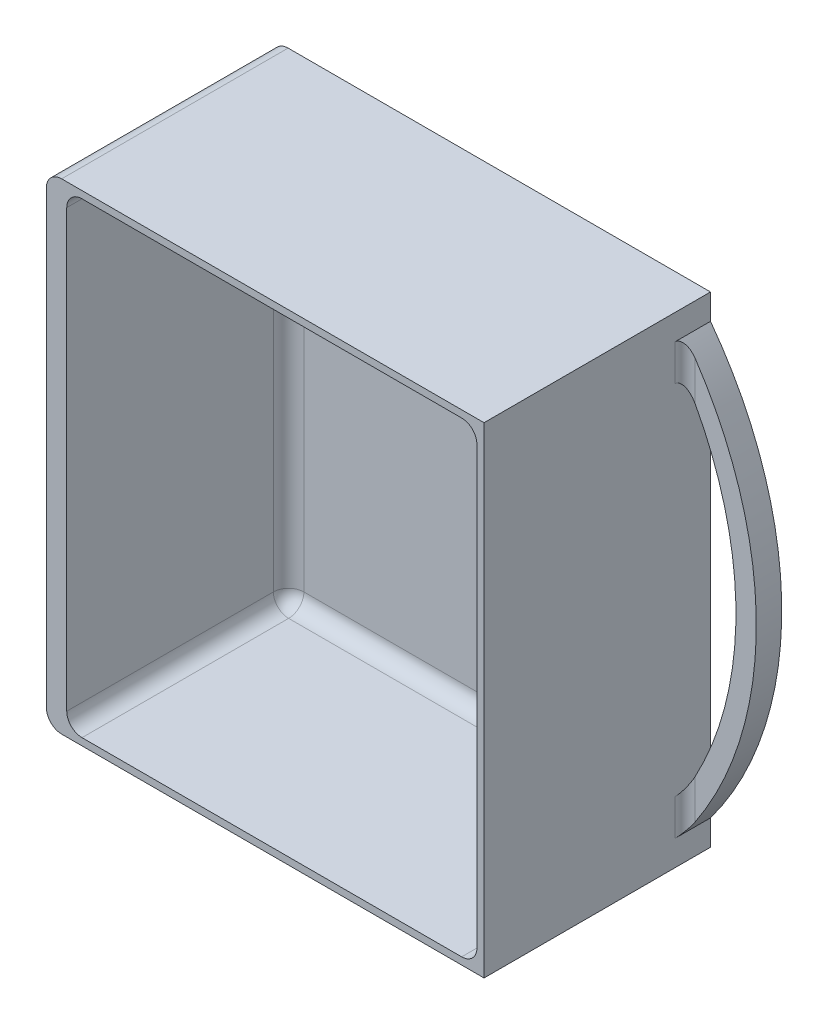
from build123d import *

# Parameters (mm, degrees)
SKETCH_1_W                  = 86
SKETCH_1_H                  = 94.5
EXTRUDE_1_DEPTH             = 39.5
EXTRUDE_2_DEPTH             = 5
SKETCH_3_W                  = 80.6
SKETCH_3_H                  = 91.7
CUT_EXTRUDE_1_DEPTH         = 43.6
HOLE_WIZARD_8_3_8_3_1_D     = 8.3
HOLE_WIZARD_8_3_8_3_1_DEPTH = 3.2
FILLET_1_R                  = 3
SKETCH_7_R                  = 4.2
EXTRUDE_3_DEPTH             = 3.8
FILLET_2_R                  = 3
FILLET_3_R                  = 3
FILLET_4_R                  = 3
FILLET_5_R                  = 3
FILLET_6_R                  = 2


with BuildPart() as part:
    # Эскиз1 → Бобышка-Вытянуть1 (new body)
    with BuildSketch(Plane.XY.offset(22.25)):
        with Locations((47, 0)):
            Rectangle(SKETCH_1_W, SKETCH_1_H)
    extrude(amount=-EXTRUDE_1_DEPTH)

    # Эскиз2 → Бобышка-Вытянуть2 (add)
    with BuildSketch(Plane(origin=(0, 0, -17.25), x_dir=(-1, 0, 0), z_dir=(0, 0, -1))):
        with BuildLine():
            Line((-90, -47.25), (-90, -42.25))
            ThreePointArc((-90, -42.25), (-104, 0), (-90, 42.25))
            Line((-90, 42.25), (-90, 47.25))
            Line((-90, 47.25), (-4, 47.25))
            Line((-4, 47.25), (-4, -47.25))
            Line((-4, -47.25), (-90, -47.25))
        make_face()
        with BuildLine():
            Line((-90, -35.143201944), (-90, 35.143201944))
            ThreePointArc((-90, 35.143201944), (-100, 0), (-90, -35.143201944))
        make_face(mode=Mode.SUBTRACT)
    extrude(amount=EXTRUDE_2_DEPTH)

    # Эскиз3 → Вырез-Вытянуть1 (cut)
    with BuildSketch(Plane.XY.offset(22.25)):
        with Locations((48.3, 0)):
            Rectangle(SKETCH_3_W, SKETCH_3_H)
    extrude(amount=-CUT_EXTRUDE_1_DEPTH, mode=Mode.SUBTRACT)

    # Диаметр отверстия Ø8.3 (8.3)1
    with Locations(Plane.ZY.offset(-4)):
        with Locations((0, 0)):
            Hole(HOLE_WIZARD_8_3_8_3_1_D / 2, depth=HOLE_WIZARD_8_3_8_3_1_DEPTH)

    # Скругление1
    fillet_1_edges = [part.edges().sort_by_distance(p)[0] for p in [
        (4, -47.25, 0),
        (4, 47.25, 0),
    ]]
    fillet(fillet_1_edges, radius=FILLET_1_R)

    # Эскиз7 → Бобышка-Вытянуть3 (add)
    with BuildSketch(Plane.ZY.offset(-4)):
        Circle(SKETCH_7_R)
    extrude(amount=-EXTRUDE_3_DEPTH)

    # Скругление2
    fillet_2_edges = [part.edges().sort_by_distance(p)[0] for p in [
        (8, 0, -21.35),
    ]]
    fillet(fillet_2_edges, radius=FILLET_2_R)

    # Скругление3
    fillet_3_edges = [part.edges().sort_by_distance(p)[0] for p in [
        (8, -45.85, 1.95),
        (49.8, -45.85, -21.35),
        (8.878679656, -45.85, -20.471320344),
    ]]
    fillet(fillet_3_edges, radius=FILLET_3_R)

    # Скругление4
    fillet_4_edges = [part.edges().sort_by_distance(p)[0] for p in [
        (49.8, 45.85, -21.35),
        (8, 45.85, 1.95),
        (8.878679656, 45.85, -20.471320344),
    ]]
    fillet(fillet_4_edges, radius=FILLET_4_R)

    # Скругление5
    fillet_5_edges = [part.edges().sort_by_distance(p)[0] for p in [
        (88.6, -45.85, 1.95),
        (88.6, 0, -21.35),
        (88.6, -44.971320344, -20.471320344),
        (88.6, 45.85, 1.95),
        (88.6, 44.971320344, -20.471320344),
    ]]
    fillet(fillet_5_edges, radius=FILLET_5_R)

    # Скругление6
    fillet_6_edges = [part.edges().sort_by_distance(p)[0] for p in [
        (90, -38.696600972, -17.25),
        (90, 38.696600972, -17.25),
    ]]
    fillet(fillet_6_edges, radius=FILLET_6_R)


solid = part.part
